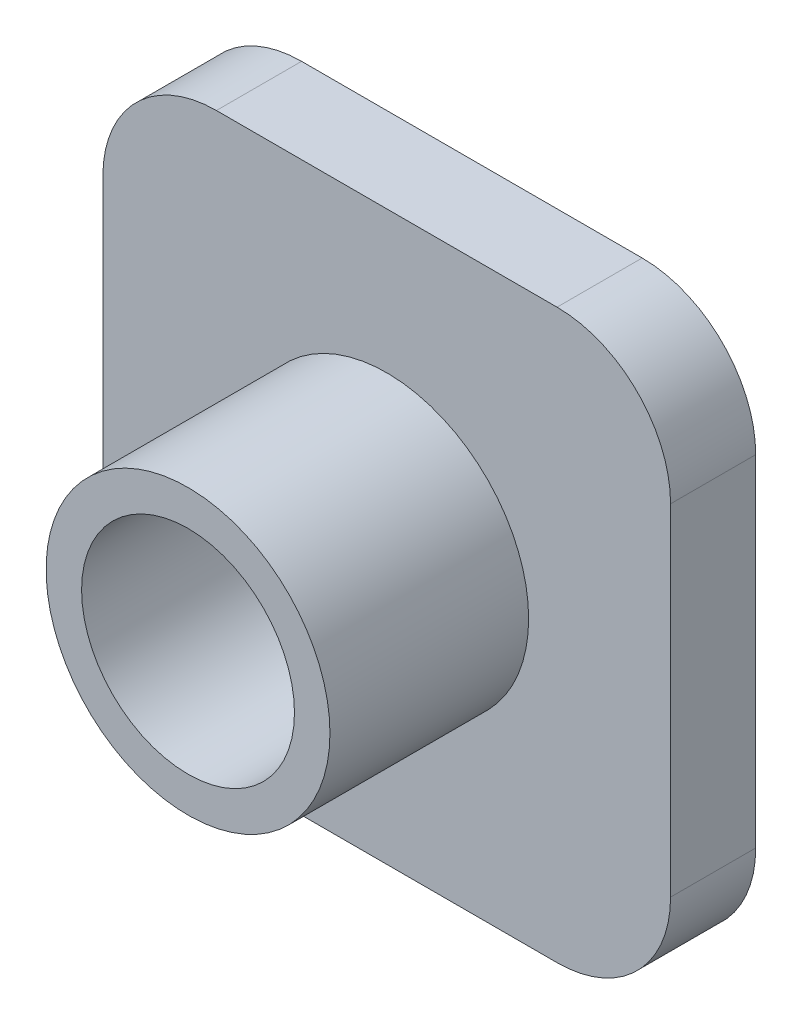
from build123d import *

# Parameters (mm, degrees)
SKETCH1_R           = 10
SKETCH1_R_2         = 7.5
BOSS_EXTRUDE1_DEPTH = 20
SKETCH2_R           = 7.5
BOSS_EXTRUDE2_DEPTH = 6


with BuildPart() as part:
    # Sketch1 → Boss-Extrude1 (new body)
    with BuildSketch(Plane.XY):
        with Locations((-123, -48)):
            Circle(SKETCH1_R)
        with Locations((-123, -48)):
            Circle(SKETCH1_R_2, mode=Mode.SUBTRACT)
    extrude(amount=BOSS_EXTRUDE1_DEPTH)

    # Sketch2 → Boss-Extrude2 (add)
    with BuildSketch(Plane(origin=(0, 0, 0), x_dir=(-1, 0, 0), z_dir=(0, 0, -1))):
        with BuildLine():
            Line((111, -28), (135, -28))
            ThreePointArc((135, -28), (140.656854249, -30.343145751), (143, -36))
            Line((143, -36), (143, -60))
            ThreePointArc((143, -60), (140.656854249, -65.656854249), (135, -68))
            Line((135, -68), (111, -68))
            ThreePointArc((111, -68), (105.343145751, -65.656854249), (103, -60))
            Line((103, -60), (103, -36))
            ThreePointArc((103, -36), (105.343145751, -30.343145751), (111, -28))
        make_face()
        with Locations(Location((123, -48, 0), (0, 0, 180))):
            Circle(SKETCH2_R, mode=Mode.SUBTRACT)
    extrude(amount=-BOSS_EXTRUDE2_DEPTH)


solid = part.part
